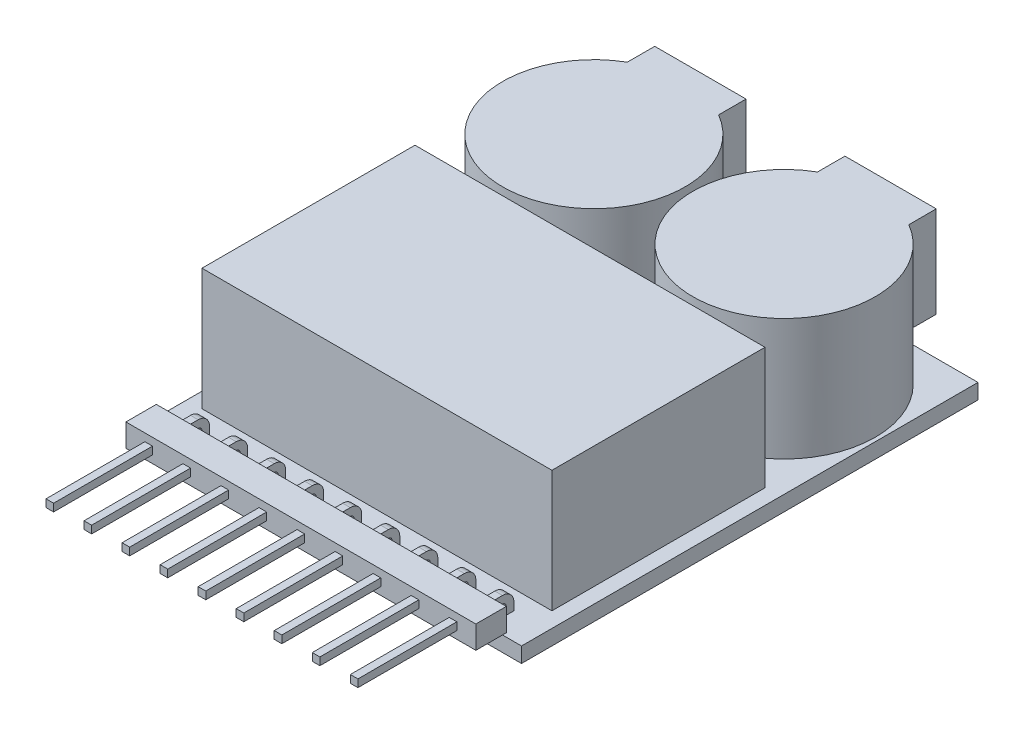
from build123d import *

# Parameters (mm, degrees)
SKIZZE1_W                 = 25
SKIZZE1_H                 = 30
GRUNDPLATTE_DEPTH         = 1
SKIZZE2_W                 = 23
SKIZZE2_H                 = 14
ZIFFERNBLATT_DEPTH        = 8
SKIZZE3_R                 = 6
BUZZER1_DEPTH             = 8
BUZZER2_DEPTH             = 1
BUZZER2_DEPTH_BACK        = 5
SKIZZE4_W                 = 6
SKIZZE4_H                 = 6
KONTAKTSTIFT_DEPTH        = 0.25
MUSTER_KONTAKTSTIFT_COUNT = 9
MUSTER_KONTAKTSTIFT_PITCH = 2.5
SKIZZE6_W                 = 23
SKIZZE6_H                 = 1.5
BUCHSENANSCHLAG_DEPTH     = 2


with BuildPart() as part:
    # Skizze1 → Grundplatte (new body)
    with BuildSketch(Plane(origin=(0, 0, 0), x_dir=(1, 0, 0), z_dir=(0, 1, 0))):
        Rectangle(SKIZZE1_W, SKIZZE1_H)
    extrude(amount=GRUNDPLATTE_DEPTH)

    # Skizze2 → Ziffernblatt (add)
    with BuildSketch(Plane(origin=(0, 1, 0), x_dir=(1, 0, 0), z_dir=(0, 1, 0))):
        with Locations((0, -5)):
            Rectangle(SKIZZE2_W, SKIZZE2_H)
    extrude(amount=ZIFFERNBLATT_DEPTH)

    # Skizze3 → Buzzer1 (add)
    with BuildSketch(Plane(origin=(0, 1, 0), x_dir=(1, 0, 0), z_dir=(0, 1, 0))):
        with Locations(Location((-6.25, 8.505687735, 0), (0, 0, 90))):
            Circle(SKIZZE3_R)
        with Locations(Location((6.25, 8.505687735, 0), (0, 0, 90))):
            Circle(SKIZZE3_R)
    extrude(amount=BUZZER1_DEPTH)

    # Skizze4 → Buzzer2 (add, two sides: drawn at the far end of the back side and taken through both)
    with BuildSketch(Plane(origin=(0, 0, -14.505687735), x_dir=(-1, 0, 0), z_dir=(0, 0, -1)).offset(-BUZZER2_DEPTH_BACK)):
        with Locations((-6.25, 6)):
            Rectangle(SKIZZE4_W, SKIZZE4_H)
        with Locations((6.25, 6)):
            Rectangle(SKIZZE4_W, SKIZZE4_H)
    extrude(amount=BUZZER2_DEPTH + BUZZER2_DEPTH_BACK)

    # Skizze5 → Kontaktstift (add, symmetric)
    with BuildSketch(Plane(origin=(10, 0, 0), x_dir=(0, 0, -1), z_dir=(1, 0, 0))):
        with BuildLine():
            Line((-13.25, 1), (-13.25, 1.5))
            ThreePointArc((-13.25, 1.5), (-13.469669914, 2.030330086), (-14, 2.25))
            Line((-14, 2.25), (-23.5, 2.25))
            Line((-23.5, 2.25), (-23.5, 1.75))
            Line((-23.5, 1.75), (-14, 1.75))
            ThreePointArc((-14, 1.75), (-13.823223305, 1.676776695), (-13.75, 1.5))
            Line((-13.75, 1.5), (-13.75, 1))
            Line((-13.75, 1), (-13.25, 1))
        make_face()
    kontaktstift = extrude(amount=KONTAKTSTIFT_DEPTH, both=True)

    # Muster_Kontaktstift: Kontaktstift ×9
    with Locations(*[(-i * MUSTER_KONTAKTSTIFT_PITCH, 0, 0) for i in range(1, MUSTER_KONTAKTSTIFT_COUNT)]):
        add(kontaktstift)

    # Skizze6 → Buchsenanschlag (add)
    with BuildSketch(Plane.XY.offset(15)):
        with Locations((0, 2)):
            Rectangle(SKIZZE6_W, SKIZZE6_H)
    extrude(amount=BUCHSENANSCHLAG_DEPTH)


solid = part.part
